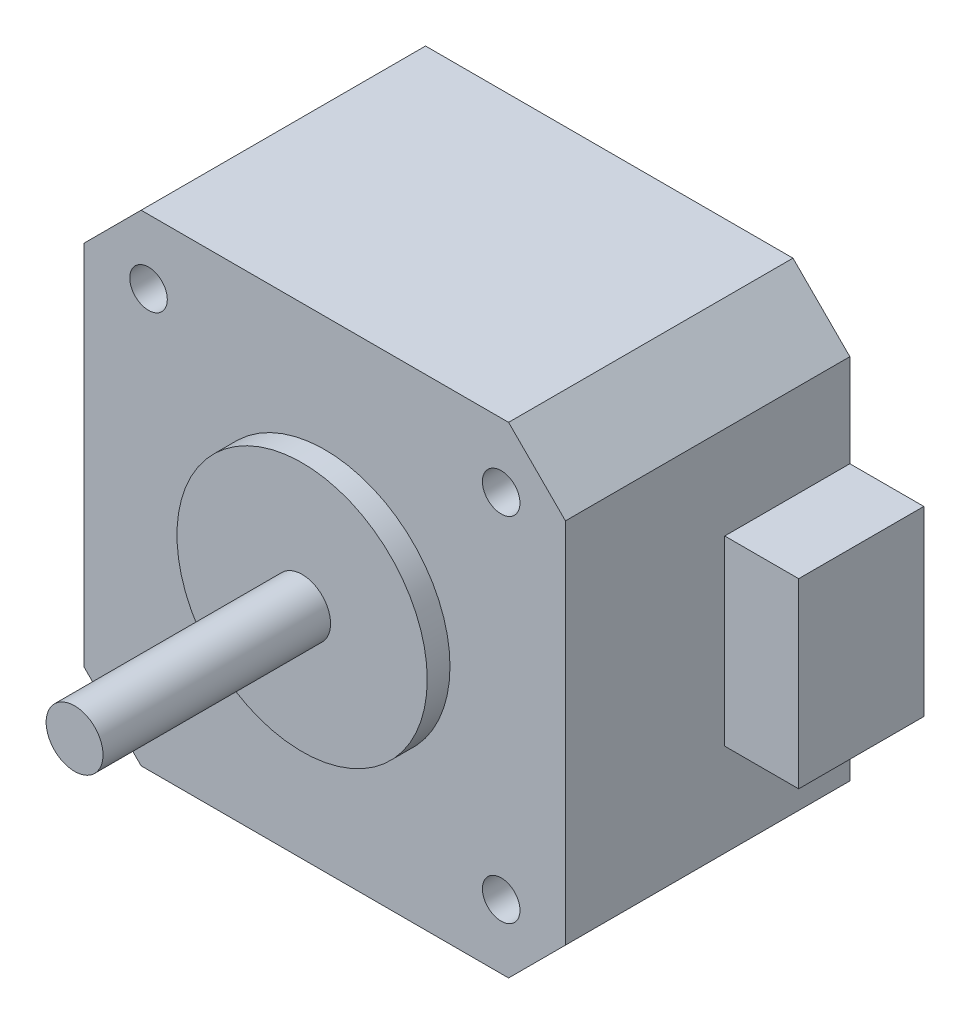
from build123d import *

# Parameters (mm, degrees)
SKETCH1_W                 = 42.3
SKETCH1_H                 = 42.3
BOSS_EXTRUDE1_DEPTH       = 25
CHAMFER1_SIZE             = 5
SKETCH3_R                 = 11
BOSS_EXTRUDE2_DEPTH       = 2
SKETCH4_R                 = 2.5
BOSS_EXTRUDE3_DEPTH       = 20
M4X0_7_TAPPED_HOLE1_D     = 3.3
M4X0_7_TAPPED_HOLE1_DEPTH = 4.5
M4X0_7_TAPPED_HOLE1_TIP   = 0.991420021
SKETCH5_W                 = 11
SKETCH5_H                 = 16
JST_XH6_CONNECTOR_DEPTH   = 6.5


with BuildPart() as part:
    # Sketch1 → Boss-Extrude1 (new body)
    with BuildSketch(Plane.XY):
        Rectangle(SKETCH1_W, SKETCH1_H)
    extrude(amount=BOSS_EXTRUDE1_DEPTH)

    # Chamfer1
    chamfer1_edges = [part.edges().sort_by_distance(p)[0] for p in [
        (21.15, -21.15, 12.5),
        (-21.15, -21.15, 12.5),
        (-21.15, 21.15, 12.5),
        (21.15, 21.15, 12.5),
    ]]
    chamfer(chamfer1_edges, length=CHAMFER1_SIZE)

    # Sketch3 → Boss-Extrude2 (add)
    with BuildSketch(Plane.XY.offset(25)):
        Circle(SKETCH3_R)
    extrude(amount=BOSS_EXTRUDE2_DEPTH)

    # Sketch4 → Boss-Extrude3 (add)
    with BuildSketch(Plane.XY.offset(27)):
        Circle(SKETCH4_R)
    extrude(amount=BOSS_EXTRUDE3_DEPTH)

    # M4x0.7 Tapped Hole1
    with Locations(Plane.XY.offset(25)):
        with Locations((-15.5, -15.5), (15.5, 15.5), (-15.5, 15.5), (15.5, -15.5)):
            Hole(M4X0_7_TAPPED_HOLE1_D / 2, depth=M4X0_7_TAPPED_HOLE1_DEPTH)
            with Locations((0, 0, -(M4X0_7_TAPPED_HOLE1_DEPTH + M4X0_7_TAPPED_HOLE1_TIP / 2))):  # 118° drill point
                Cone(0, M4X0_7_TAPPED_HOLE1_D / 2, M4X0_7_TAPPED_HOLE1_TIP, mode=Mode.SUBTRACT)


with BuildPart() as body_2:
    # Sketch5 → JST-XH6 Connector (new body)
    with BuildSketch(Plane(origin=(21.15, 0, 0), x_dir=(0, 0, -1), z_dir=(1, 0, 0))):
        with Locations((-5.5, 0)):
            Rectangle(SKETCH5_W, SKETCH5_H)
    extrude(amount=JST_XH6_CONNECTOR_DEPTH)


solid = Compound([part.part, body_2.part])
